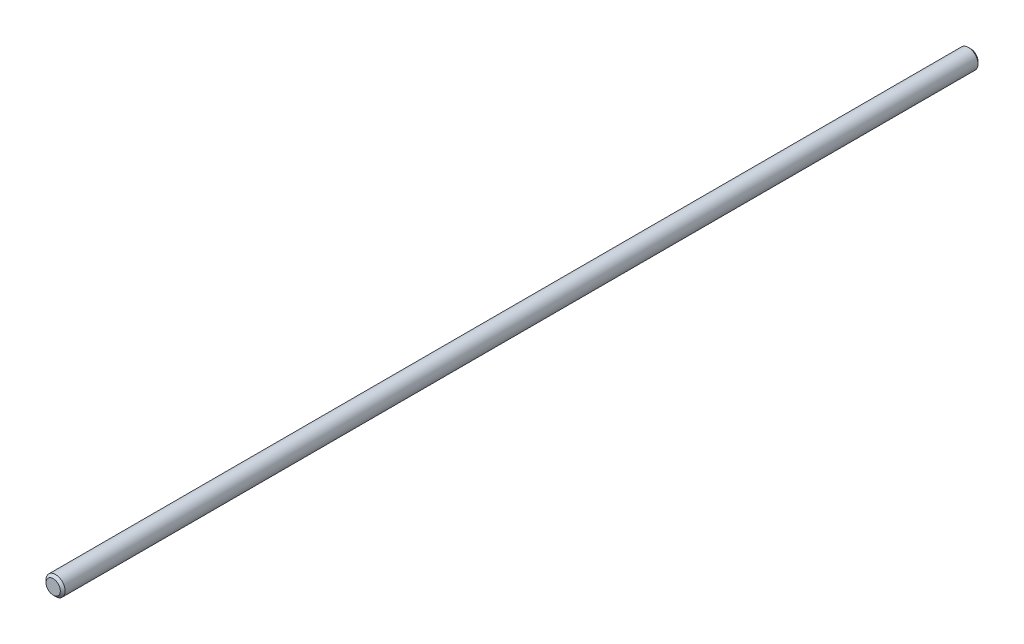
from build123d import *

# Parameters (mm, degrees)
SKETCH2_W     = 457.2
SKETCH2_H     = 4.7625
CHAMFER1_SIZE = 1.190625


with BuildPart() as part:
    # Sketch2 → Revolve1 (revolve)
    with BuildSketch(Plane(origin=(0, 0, 0), x_dir=(0, 0, -1), z_dir=(1, 0, 0))):
        with Locations((0, 2.38125)):
            Rectangle(SKETCH2_W, SKETCH2_H)
    revolve(axis=Axis((0, 0, 228.6), (0, 0, -1)))

    # Chamfer1
    chamfer1_edges = [part.edges().sort_by_distance(p)[0] for p in [
        (0, -4.7625, -228.6),
        (0, -4.7625, 228.6),
    ]]
    chamfer(chamfer1_edges, length=CHAMFER1_SIZE)


solid = part.part
